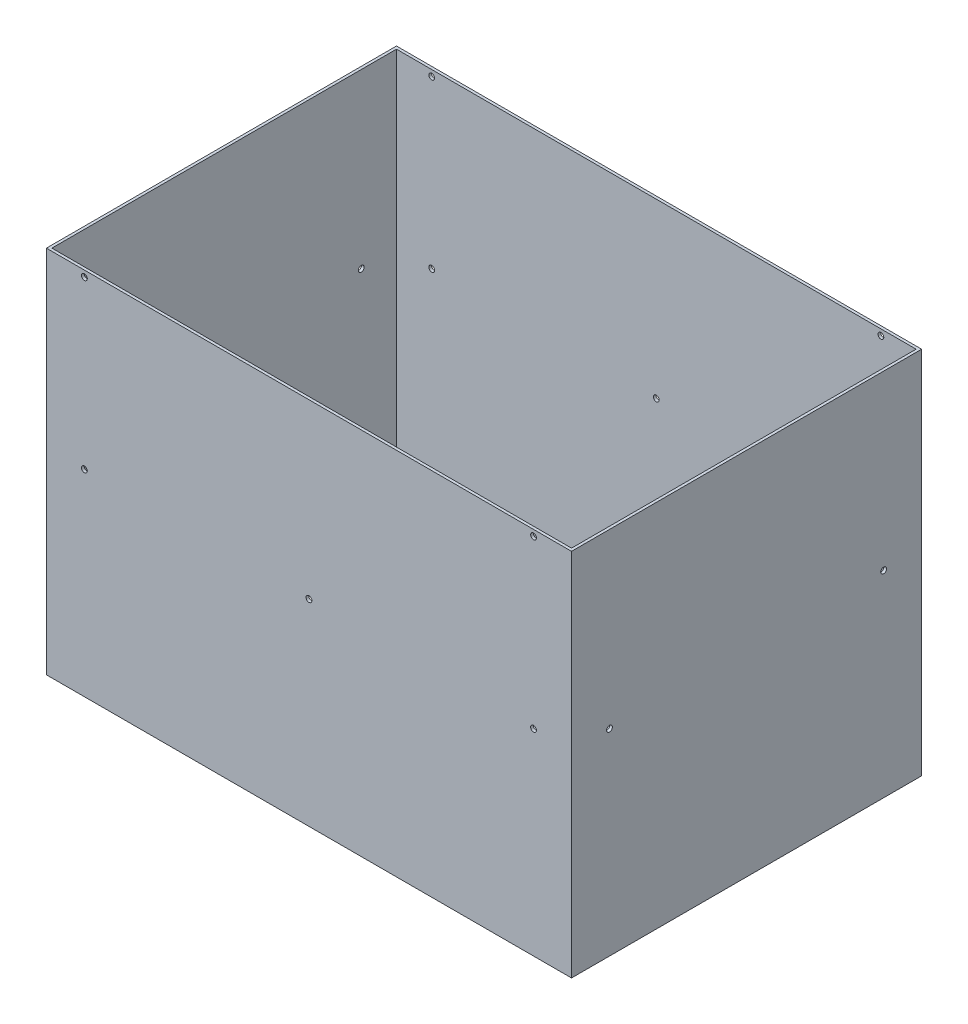
from build123d import *

# Parameters (mm, degrees)
CROQUIS1_W                 = 270
CROQUIS1_H                 = 190
SALIENTE_EXTRUIR1_DEPTH    = 90
CROQUIS2_W                 = 60
CROQUIS2_H                 = 133
CORTAR_EXTRUIR2_DEPTH      = 35.7
CROQUIS6_W                 = 267.2
CROQUIS6_H                 = 177.2
CORTAR_EXTRUIR3_DEPTH      = 188.6
CROQUIS8_R                 = 1.5
CORTAR_EXTRUIR4_DEPTH      = 300
CORTAR_EXTRUIR6_DEPTH      = 135
CORTAR_EXTRUIR6_DEPTH_BACK = 368
CROQUIS10_R                = 1.5
CORTAR_EXTRUIR7_DEPTH      = 112
CORTAR_EXTRUIR7_DEPTH_BACK = 260.1
CROQUIS11_R                = 1.5


with BuildPart() as part:
    # Croquis1 → Saliente-Extruir1 (new, symmetric)
    with BuildSketch(Plane.XY):
        with Locations((0, 48.4)):
            Rectangle(CROQUIS1_W, CROQUIS1_H)
    extrude(amount=SALIENTE_EXTRUIR1_DEPTH, both=True)

    # Croquis2 → Cortar-Extruir2 (cut, symmetric)
    with BuildSketch(Plane(origin=(0, -46.6, 0), x_dir=(1, 0, 0), z_dir=(0, 1, 0))):
        with Locations((-96, 9.5)):
            Rectangle(CROQUIS2_W, CROQUIS2_H)
        with Locations((99.26, -13.5)):
            Rectangle(CROQUIS2_W, CROQUIS2_H)
    extrude(amount=CORTAR_EXTRUIR2_DEPTH, both=True, mode=Mode.SUBTRACT)

    # Croquis6 → Cortar-Extruir3 (cut)
    with BuildSketch(Plane(origin=(0, 143.4, 0), x_dir=(1, 0, 0), z_dir=(0, 1, 0))):
        Rectangle(CROQUIS6_W, CROQUIS6_H)
    extrude(amount=-CORTAR_EXTRUIR3_DEPTH, mode=Mode.SUBTRACT)

    # Croquis8 → Cortar-Extruir4 (cut, symmetric)
    with BuildSketch(Plane.XY.offset(90)):
        with Locations((-115.475, 54.65)):
            Circle(CROQUIS8_R)
        with Locations((0, 54.65)):
            Circle(CROQUIS8_R)
        with Locations((115.475, 54.65)):
            Circle(CROQUIS8_R)
    extrude(amount=CORTAR_EXTRUIR4_DEPTH, both=True, mode=Mode.SUBTRACT)

    # Croquis10 → Cortar-Extruir6 (cut, two sides: drawn at the far end of the back side and taken through both)
    with BuildSketch(Plane.ZY.offset(135).offset(-CORTAR_EXTRUIR6_DEPTH_BACK)):
        with Locations(Location((-70.475, 54.65, 0), (0, 0, 180))):
            Circle(CROQUIS10_R)
        with Locations(Location((70.475, 54.65, 0), (0, 0, 180))):
            Circle(CROQUIS10_R)
    extrude(amount=CORTAR_EXTRUIR6_DEPTH + CORTAR_EXTRUIR6_DEPTH_BACK, mode=Mode.SUBTRACT)

    # Croquis11 → Cortar-Extruir7 (cut, two sides: drawn at the far end of the back side and taken through both)
    with BuildSketch(Plane.XY.offset(90).offset(-CORTAR_EXTRUIR7_DEPTH_BACK)):
        with Locations(Location((-115.475, 140.275, 0), (0, 0, 180))):
            Circle(CROQUIS11_R)
        with Locations(Location((115.475, 140.275, 0), (0, 0, 180))):
            Circle(CROQUIS11_R)
    extrude(amount=CORTAR_EXTRUIR7_DEPTH + CORTAR_EXTRUIR7_DEPTH_BACK, mode=Mode.SUBTRACT)


solid = part.part
